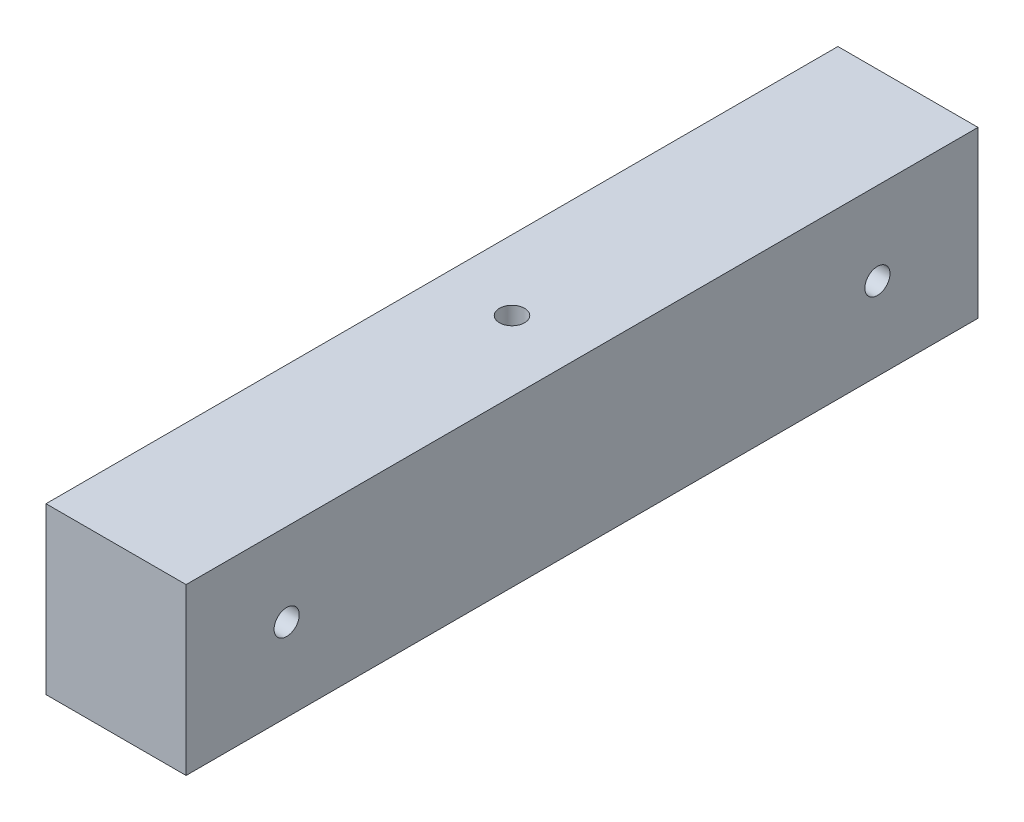
from build123d import *

# Parameters (mm, degrees)
SKETCH1_W           = 17.69
SKETCH1_H           = 20.88
BOSS_EXTRUDE1_DEPTH = 100
SKETCH2_R           = 1.5875
CUT_EXTRUDE1_DEPTH  = 106.78
SKETCH3_R           = 1.5875
CUT_EXTRUDE2_DEPTH  = 100


with BuildPart() as part:
    # Sketch1 → Boss-Extrude1 (new body)
    with BuildSketch(Plane.XY):
        with Locations((8.845, 10.44)):
            Rectangle(SKETCH1_W, SKETCH1_H)
    extrude(amount=BOSS_EXTRUDE1_DEPTH)

    # Sketch2 → Cut-Extrude1 (cut)
    with BuildSketch(Plane(origin=(0, 20.88, 0), x_dir=(1, 0, 0), z_dir=(0, 1, 0))):
        with Locations(Location((8.845, -50, 0), (0, 0, 270))):
            Circle(SKETCH2_R)
    extrude(amount=-CUT_EXTRUDE1_DEPTH, mode=Mode.SUBTRACT)

    # Sketch3 → Cut-Extrude2 (cut)
    with BuildSketch(Plane(origin=(17.69, 0, 0), x_dir=(0, 0, -1), z_dir=(1, 0, 0))):
        with Locations(Location((-87.3, 10.44, 0), (0, 0, 90))):
            Circle(SKETCH3_R)
        with Locations(Location((-12.7, 10.44, 0), (0, 0, 90))):
            Circle(SKETCH3_R)
    extrude(amount=-CUT_EXTRUDE2_DEPTH, mode=Mode.SUBTRACT)


solid = part.part
